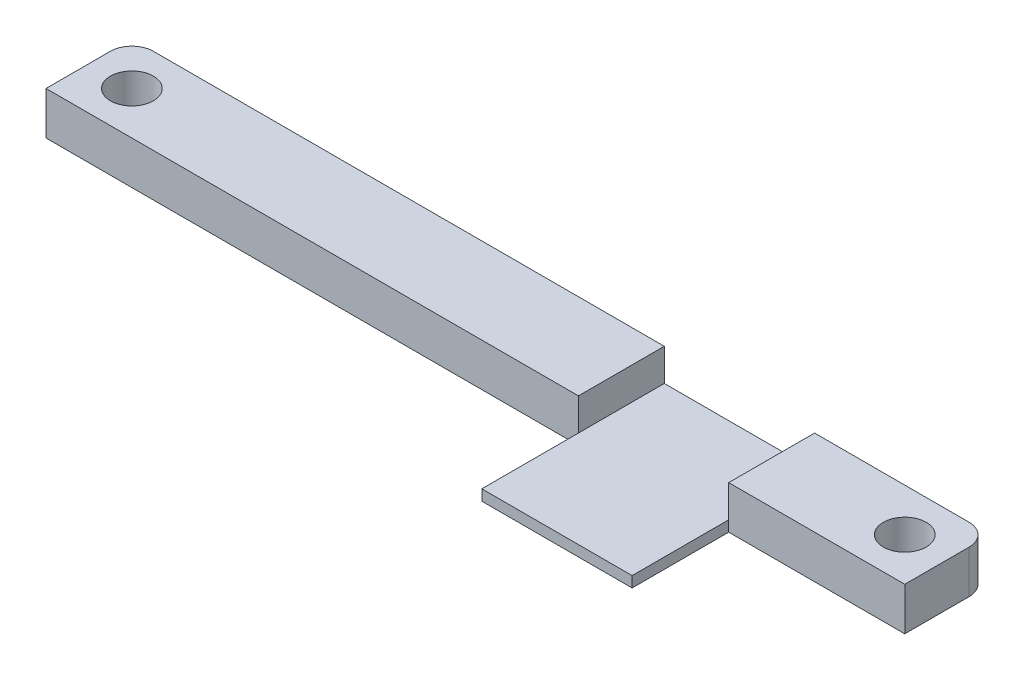
from build123d import *

# Parameters (mm, degrees)
EXTRUDE_1_DEPTH     = 12
CUT_EXTRUDE_1_DEPTH = 12
SKETCH_3_R          = 2
CUT_EXTRUDE_2_DEPTH = 12
CUT_EXTRUDE_3_DEPTH = 1
SKETCH_5_W          = 80
SKETCH_5_H          = 4
CUT_EXTRUDE_4_DEPTH = 20
EXTRUDE_2_DEPTH     = 1
SKETCH_7_W          = 0.2
SKETCH_7_H          = 8
CUT_EXTRUDE_5_DEPTH = 1
SKETCH_8_R          = 2
EXTRUDE_3_DEPTH     = 4
SKETCH_9_W          = 80
SKETCH_9_H          = 8
CUT_EXTRUDE_6_DEPTH = 10
SKETCH_10_W         = 14
SKETCH_10_H         = 8
CUT_EXTRUDE_7_DEPTH = 2
SKETCH_11_W         = 14
SKETCH_11_H         = 9
EXTRUDE_4_DEPTH     = 2
SKETCH_12_W         = 14
SKETCH_12_H         = 1
CUT_EXTRUDE_8_DEPTH = 20


with BuildPart() as part:
    # 草图1 → 凸台-拉伸1 (new body)
    with BuildSketch(Plane(origin=(0, 0, 0), x_dir=(1, 0, 0), z_dir=(0, 1, 0))):
        Polygon((-40, -6), (0, -6), (40, -6), (40, 0), (40, 6), (0, 6), (-36, 6), (-40, 6), align=None)
    extrude(amount=EXTRUDE_1_DEPTH)

    # 草图2 → 切除-拉伸1 (cut)
    with BuildSketch(Plane.XY.offset(6)):
        Polygon((-28, 0), (0, 0), (28, 0), (28, 4), (28, 8), (-28, 8), (-28, 4), align=None)
        Polygon((-40, 4), (-32, 4), (-32, 8), (-32, 12), (-40, 12), align=None)
        Polygon((32, 8), (32, 4), (40, 4), (40, 12), (32, 12), align=None)
    extrude(amount=-CUT_EXTRUDE_1_DEPTH, mode=Mode.SUBTRACT)

    # 草图3 → 切除-拉伸2 (cut)
    with BuildSketch(Plane(origin=(0, 12, 0), x_dir=(1, 0, 0), z_dir=(0, 1, 0))):
        with BuildLine():
            Line((-40, 6), (-40, 4))
            ThreePointArc((-40, 4), (-39.414213562, 5.414213562), (-38, 6))
            Line((-38, 6), (-40, 6))
        make_face()
        with Locations(Location((-36, 2, 0), (0, 0, 270))):
            Circle(SKETCH_3_R)
        with BuildLine():
            ThreePointArc((40, 4), (39.414213562, 5.414213562), (38, 6))
            Line((38, 6), (40, 6))
            Line((40, 6), (40, 4))
        make_face()
        with Locations(Location((36, 2, 0), (0, 0, 270))):
            Circle(SKETCH_3_R)
    extrude(amount=-CUT_EXTRUDE_2_DEPTH, mode=Mode.SUBTRACT)

    # 草图4 → 切除-拉伸3 (cut)
    with BuildSketch(Plane(origin=(0, 12, 0), x_dir=(1, 0, 0), z_dir=(0, 1, 0))):
        Polygon((-21.1, 0), (-21.1, 6), (-16.6, 6), (-12.1, 6), (12.08, 6), (16.6, 6), (21.12, 6), (21.12, -1), (21.12, -6), (16.6, -6), (12.08, -6), (12.08, -1), (12.08, 0), (-12.1, 0), (-12.1, -6), (-16.6, -6), (-21.1, -6), align=None)
    extrude(amount=-CUT_EXTRUDE_3_DEPTH, mode=Mode.SUBTRACT)

    # 草图5 → 切除-拉伸4 (cut)
    with BuildSketch(Plane(origin=(0, 12, 0), x_dir=(1, 0, 0), z_dir=(0, 1, 0))):
        with Locations((0, -4)):
            Rectangle(SKETCH_5_W, SKETCH_5_H)
    extrude(amount=-CUT_EXTRUDE_4_DEPTH, mode=Mode.SUBTRACT)

    # 草图6 → 凸台-拉伸2 (add)
    with BuildSketch(Plane(origin=(0, 12, 0), x_dir=(1, 0, 0), z_dir=(0, 1, 0))):
        Polygon((12.08, 0), (12.08, 6), (-21.1, 6), (-21.1, -2), (-12.1, -2), (-12.1, 0), align=None)
    extrude(amount=-EXTRUDE_2_DEPTH)

    # 草图7 → 切除-拉伸5 (cut)
    with BuildSketch(Plane(origin=(0, 12, 0), x_dir=(1, 0, 0), z_dir=(0, 1, 0))):
        with Locations((21.22, 2)):
            Rectangle(SKETCH_7_W, SKETCH_7_H)
        with Locations((11.98, 2)):
            Rectangle(SKETCH_7_W, SKETCH_7_H)
    extrude(amount=-CUT_EXTRUDE_5_DEPTH, mode=Mode.SUBTRACT)

    # 草图8 → 凸台-拉伸3 (add)
    # profile 1 of 2: a face of its own
    with BuildSketch(Plane(origin=(0, 12, 0), x_dir=(1, 0, 0), z_dir=(0, 1, 0))):
        with BuildLine():
            Line((-32, -2), (-40, -2))
            Line((-40, -2), (-40, 4))
            ThreePointArc((-40, 4), (-39.414213562, 5.414213562), (-38, 6))
            Line((-38, 6), (-32, 6))
            Line((-32, 6), (-32, -2))
        make_face()
        with Locations(Location((-36, 2, 0), (0, 0, 270))):
            Circle(SKETCH_8_R, mode=Mode.SUBTRACT)
    # profile 2 of 2: a face of its own
    with BuildSketch(Plane(origin=(0, 12, 0), x_dir=(1, 0, 0), z_dir=(0, 1, 0))):
        with BuildLine():
            Line((32, -2), (32, 6))
            Line((32, 6), (38, 6))
            ThreePointArc((38, 6), (39.414213562, 5.414213562), (40, 4))
            Line((40, 4), (40, -2))
            Line((40, -2), (32, -2))
        make_face()
        with Locations(Location((36, 2, 0), (0, 0, 270))):
            Circle(SKETCH_8_R, mode=Mode.SUBTRACT)
    extrude(amount=-EXTRUDE_3_DEPTH)

    # 草图9 → 切除-拉伸6 (cut)
    with BuildSketch(Plane.XY.offset(2)):
        with Locations((0, 4)):
            Rectangle(SKETCH_9_W, SKETCH_9_H)
    extrude(amount=-CUT_EXTRUDE_6_DEPTH, mode=Mode.SUBTRACT)

    # 草图10 → 切除-拉伸7 (cut)
    with BuildSketch(Plane(origin=(0, 12, 0), x_dir=(1, 0, 0), z_dir=(0, 1, 0))):
        with Locations((16.6, 2)):
            Rectangle(SKETCH_10_W, SKETCH_10_H)
    extrude(amount=-CUT_EXTRUDE_7_DEPTH, mode=Mode.SUBTRACT)

    # 草图11 → 凸台-拉伸4 (add)
    with BuildSketch(Plane(origin=(0, 10, 0), x_dir=(1, 0, 0), z_dir=(0, 1, 0))):
        with Locations((16.6, -6.5)):
            Rectangle(SKETCH_11_W, SKETCH_11_H)
    extrude(amount=-EXTRUDE_4_DEPTH)

    # 草图12 → 切除-拉伸8 (cut)
    with BuildSketch(Plane(origin=(0, 0, -6), x_dir=(-1, 0, 0), z_dir=(0, 0, -1))):
        with Locations((-16.6, 9.5)):
            Rectangle(SKETCH_12_W, SKETCH_12_H)
    extrude(amount=-CUT_EXTRUDE_8_DEPTH, mode=Mode.SUBTRACT)


solid = part.part
